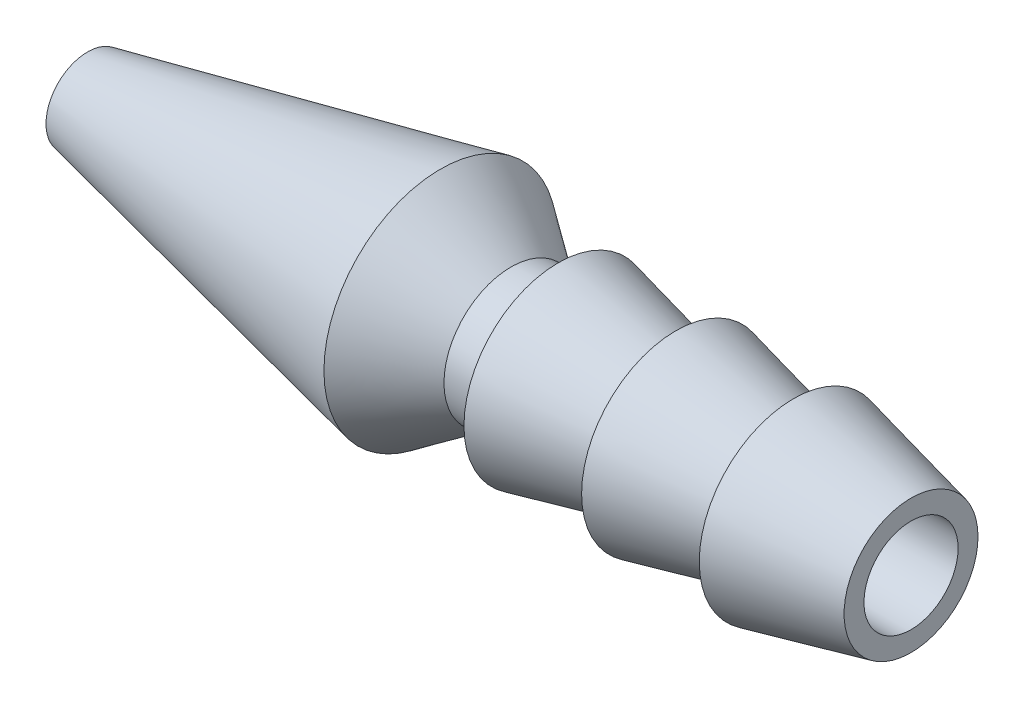
from build123d import *

# Parameters (mm, degrees)
SKETCH1_R           = 4
BOSS_EXTRUDE1_DEPTH = 5
BOSS_EXTRUDE1_TAPER = 13
SKETCH2_R           = 4
BOSS_EXTRUDE2_DEPTH = 5
BOSS_EXTRUDE2_TAPER = 13
SKETCH3_R           = 4
BOSS_EXTRUDE3_DEPTH = 5
BOSS_EXTRUDE3_TAPER = 13
SKETCH4_R           = 2.85
BOSS_EXTRUDE4_DEPTH = 2
SKETCH5_R           = 2.85
BOSS_EXTRUDE5_DEPTH = 3
BOSS_EXTRUDE5_DRAFT = -35
SKETCH6_R           = 4.950622615
BOSS_EXTRUDE6_DEPTH = 15
BOSS_EXTRUDE6_TAPER = 12
SKETCH9_R           = 2
CUT_EXTRUDE1_DEPTH  = 20
SKETCH12_W          = 2.479913688
SKETCH12_H          = 0.4
CUT_EXTRUDE10_DEPTH = 10
SKETCH14_R          = 2
CUT_EXTRUDE11_DEPTH = 10
CUT_EXTRUDE11_DRAFT = -11.2


with BuildPart() as part:
    # Sketch1 → Boss-Extrude1 (new body)
    with BuildSketch(Plane(origin=(0, 0, 0), x_dir=(0, 0, -1), z_dir=(1, 0, 0))):
        Circle(SKETCH1_R)
    extrude(amount=BOSS_EXTRUDE1_DEPTH, taper=BOSS_EXTRUDE1_TAPER)

    # Sketch2 → Boss-Extrude2 (add)
    with BuildSketch(Plane(origin=(5, 0, 0), x_dir=(0, 0, -1), z_dir=(1, 0, 0))):
        Circle(SKETCH2_R)
    extrude(amount=BOSS_EXTRUDE2_DEPTH, taper=BOSS_EXTRUDE2_TAPER)

    # Sketch3 → Boss-Extrude3 (add)
    with BuildSketch(Plane(origin=(10, 0, 0), x_dir=(0, 0, -1), z_dir=(1, 0, 0))):
        Circle(SKETCH3_R)
    extrude(amount=BOSS_EXTRUDE3_DEPTH, taper=BOSS_EXTRUDE3_TAPER)

    # Sketch4 → Boss-Extrude4 (add)
    with BuildSketch(Plane.ZY):
        Circle(SKETCH4_R)
    extrude(amount=BOSS_EXTRUDE4_DEPTH)


with BuildPart() as boss_extrude5_tool:
    # Sketch5 → Boss-Extrude5 (with draft: the straight prism first)
    with BuildSketch(Plane.ZY.offset(2)):
        Circle(SKETCH5_R)
    extrude(amount=BOSS_EXTRUDE5_DEPTH)
    # Boss-Extrude5: the draft: its side faces are tilted about the plane it starts from
    boss_extrude5_sides = [boss_extrude5_tool.faces().sort_by_distance(p)[0] for p in [
        (-3.5, 0, -2.85),
    ]]
    draft(boss_extrude5_sides, Plane.ZY.offset(2), BOSS_EXTRUDE5_DRAFT)


with BuildPart() as part_1:
    add(part.part)

    # Boss-Extrude5: add boss_extrude5_tool
    add(boss_extrude5_tool.part)

    # Sketch6 → Boss-Extrude6 (add)
    with BuildSketch(Plane.ZY.offset(5)):
        Circle(SKETCH6_R)
    extrude(amount=BOSS_EXTRUDE6_DEPTH, taper=BOSS_EXTRUDE6_TAPER)

    # Sketch9 → Cut-Extrude1 (cut)
    with BuildSketch(Plane(origin=(15, 0, 0), x_dir=(0, 0, -1), z_dir=(1, 0, 0))):
        Circle(SKETCH9_R)
    extrude(amount=-CUT_EXTRUDE1_DEPTH, mode=Mode.SUBTRACT)

    # Sketch12 → Cut-Extrude10 (cut)
    with BuildSketch(Plane.ZY.offset(20)):
        Rectangle(SKETCH12_W, SKETCH12_H)
    extrude(amount=-CUT_EXTRUDE10_DEPTH, mode=Mode.SUBTRACT)


with BuildPart() as cut_extrude11_tool:
    # Sketch14 → Cut-Extrude11 (with draft: the straight prism first)
    with BuildSketch(Plane(origin=(-5, 0, 0), x_dir=(0, 0, -1), z_dir=(1, 0, 0))):
        Circle(SKETCH14_R)
    extrude(amount=-CUT_EXTRUDE11_DEPTH)
    # Cut-Extrude11: the draft: its side faces are tilted about the plane it starts from
    cut_extrude11_sides = [cut_extrude11_tool.faces().sort_by_distance(p)[0] for p in [
        (-10, 0, 2),
    ]]
    draft(cut_extrude11_sides, Plane(origin=(-5, 0, 0), x_dir=(0, 0, -1), z_dir=(1, 0, 0)), CUT_EXTRUDE11_DRAFT)


with BuildPart() as part_2:
    add(part_1.part)

    # Cut-Extrude11: cut by cut_extrude11_tool
    add(cut_extrude11_tool.part, mode=Mode.SUBTRACT)


solid = part_2.part
